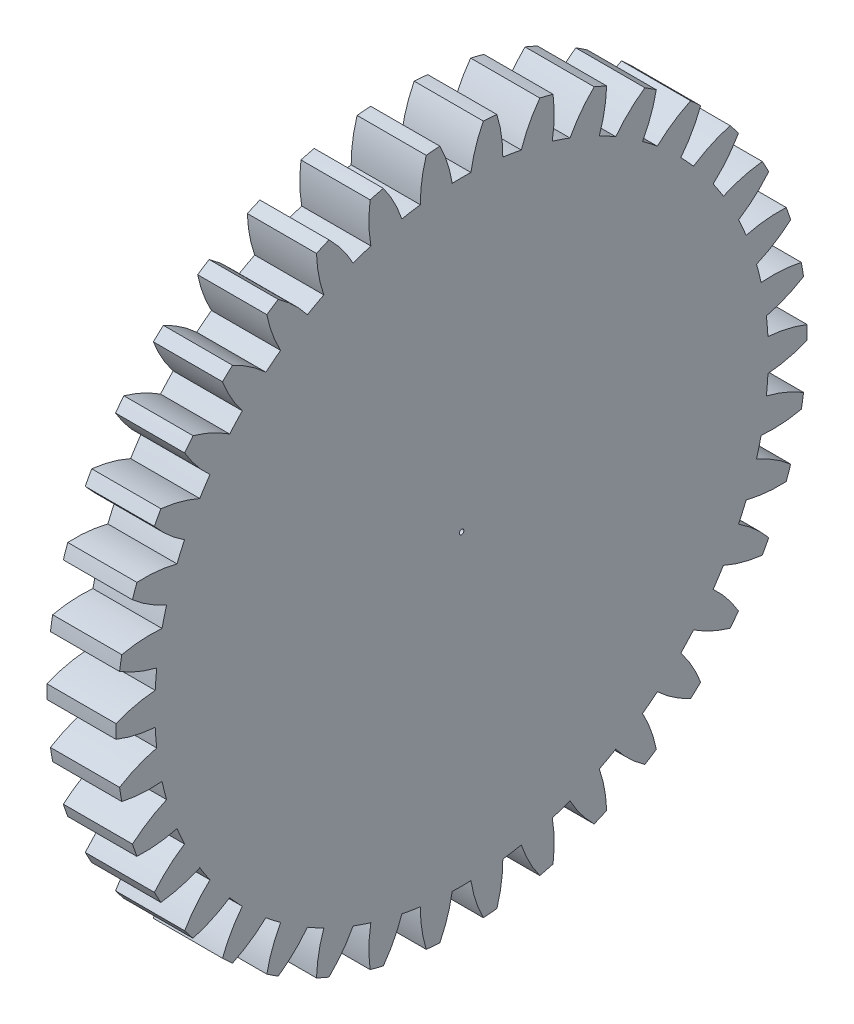
from build123d import *

# Parameters (mm, degrees)
BASPROSKE_W     = 12
BASPROSKE_H     = 60
TOOTHCUT_DEPTH  = 86.697141143
TEETHCUTS_COUNT = 38
TEETHCUTS_ANGLE = 350.526315789
BORSKE_R        = 0.4
BORE_DEPTH      = 50.0000508


with BuildPart() as part:
    # BasProSke → Base-Revolve (revolve)
    with BuildSketch(Plane(origin=(0, 0, 0), x_dir=(1, 0, 0), z_dir=(0, 1, 0)), mode=Mode.PRIVATE) as base_revolve_sk:
        with Locations((6, 30)):
            Rectangle(BASPROSKE_W, BASPROSKE_H)
    revolve(base_revolve_sk.sketch.rotate(Axis((-10, 0, 0), (1, 0, 0)), 180), axis=Axis((-10, 0, 0), (1, 0, 0)))

    # TooCutSke → ToothCut (cut, through all)
    with BuildSketch(Plane(origin=(0, 0, 0), x_dir=(0, 0, -1), z_dir=(1, 0, 0))):
        with BuildLine():
            ThreePointArc((1.622407022, 53.224278261), (0, 53.249), (-1.622407022, 53.224278261))
            ThreePointArc((-1.622407022, 53.224278261), (-2.445225008, 56.64888489), (-3.785666911, 59.90590431))
            ThreePointArc((-3.785666911, 59.90590431), (0, 60.0254), (3.785666911, 59.90590431))
            ThreePointArc((3.785666911, 59.90590431), (2.445225008, 56.64888489), (1.622407022, 53.224278261))
        make_face()
    toothcut = extrude(amount=TOOTHCUT_DEPTH, mode=Mode.SUBTRACT)

    # TeethCuts: ToothCut ×38 about axis
    teethcuts_axis = Axis((-10, 0, 0), (1, 0, 0))
    for i in range(1, TEETHCUTS_COUNT):
        add(toothcut.rotate(teethcuts_axis, i * TEETHCUTS_ANGLE / (TEETHCUTS_COUNT - 1)), mode=Mode.SUBTRACT)

    # BorSke → Bore (cut, symmetric)
    with BuildSketch(Plane(origin=(0, 0, 0), x_dir=(0, 0, -1), z_dir=(1, 0, 0))):
        with Locations(Location((0, 0, 0), (0, 0, 180))):
            Circle(BORSKE_R)
    extrude(amount=BORE_DEPTH, both=True, mode=Mode.SUBTRACT)


solid = part.part
